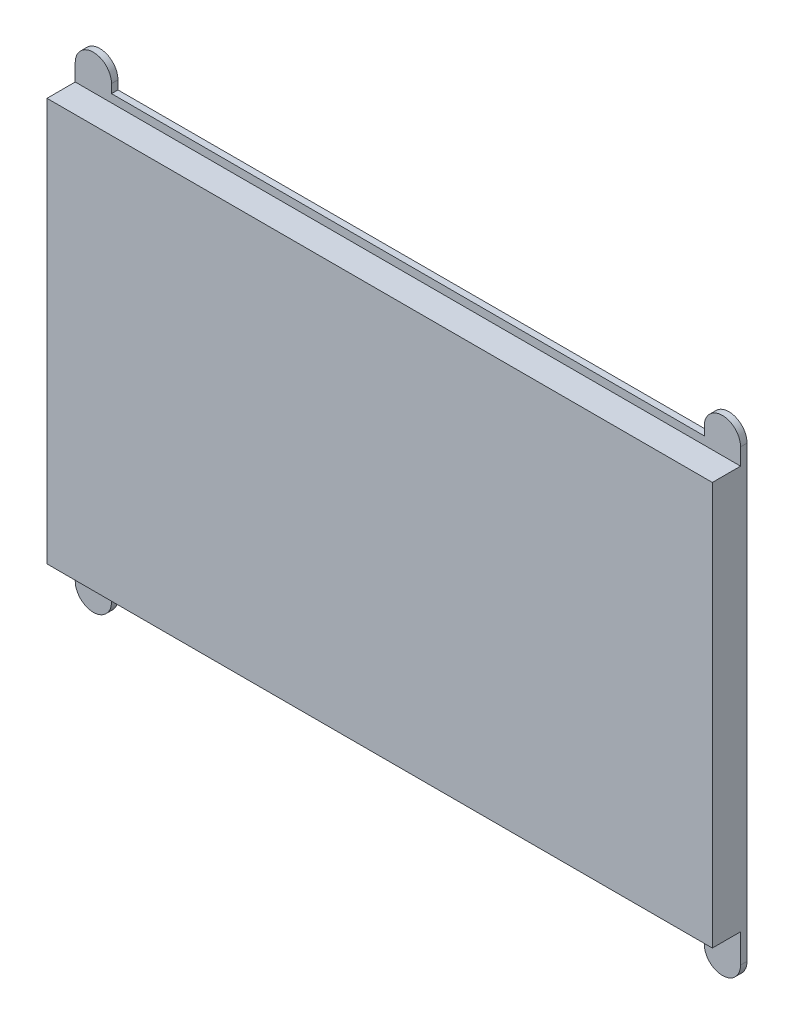
from build123d import *

# Parameters (mm, degrees)
BOSS_EXTRU_1_DEPTH = 1.6
ESQUISSE2_W        = 165
ESQUISSE2_H        = 100
BOSS_EXTRU_2_DEPTH = 7


with BuildPart() as part:
    # Esquisse1 → Boss.-Extru.1 (new body)
    with BuildSketch(Plane.XY):
        with BuildLine():
            Line((-82.5, 53.5), (-82.5, 55.65))
            ThreePointArc((-82.5, 55.65), (-78, 60.15), (-73.5, 55.65))
            Line((-73.5, 55.65), (-73.5, 53.5))
            Line((-73.5, 53.5), (73.5, 53.5))
            Line((73.5, 53.5), (73.5, 55.65))
            ThreePointArc((73.5, 55.65), (78, 60.15), (82.5, 55.65))
            Line((82.5, 55.65), (82.5, 53.5))
            Line((82.5, 53.5), (82.5, -53.5))
            Line((82.5, -53.5), (82.5, -55.65))
            ThreePointArc((82.5, -55.65), (78, -60.15), (73.5, -55.65))
            Line((73.5, -55.65), (73.5, -53.5))
            Line((73.5, -53.5), (-73.5, -53.5))
            Line((-73.5, -53.5), (-73.5, -55.65))
            ThreePointArc((-73.5, -55.65), (-78, -60.15), (-82.5, -55.65))
            Line((-82.5, -55.65), (-82.5, -53.5))
            Line((-82.5, -53.5), (-82.5, 53.5))
        make_face()
    extrude(amount=BOSS_EXTRU_1_DEPTH)

    # Esquisse2 → Boss.-Extru.2 (add)
    with BuildSketch(Plane.XY.offset(1.6)):
        with Locations((0, 1.5)):
            Rectangle(ESQUISSE2_W, ESQUISSE2_H)
    extrude(amount=BOSS_EXTRU_2_DEPTH)


solid = part.part
